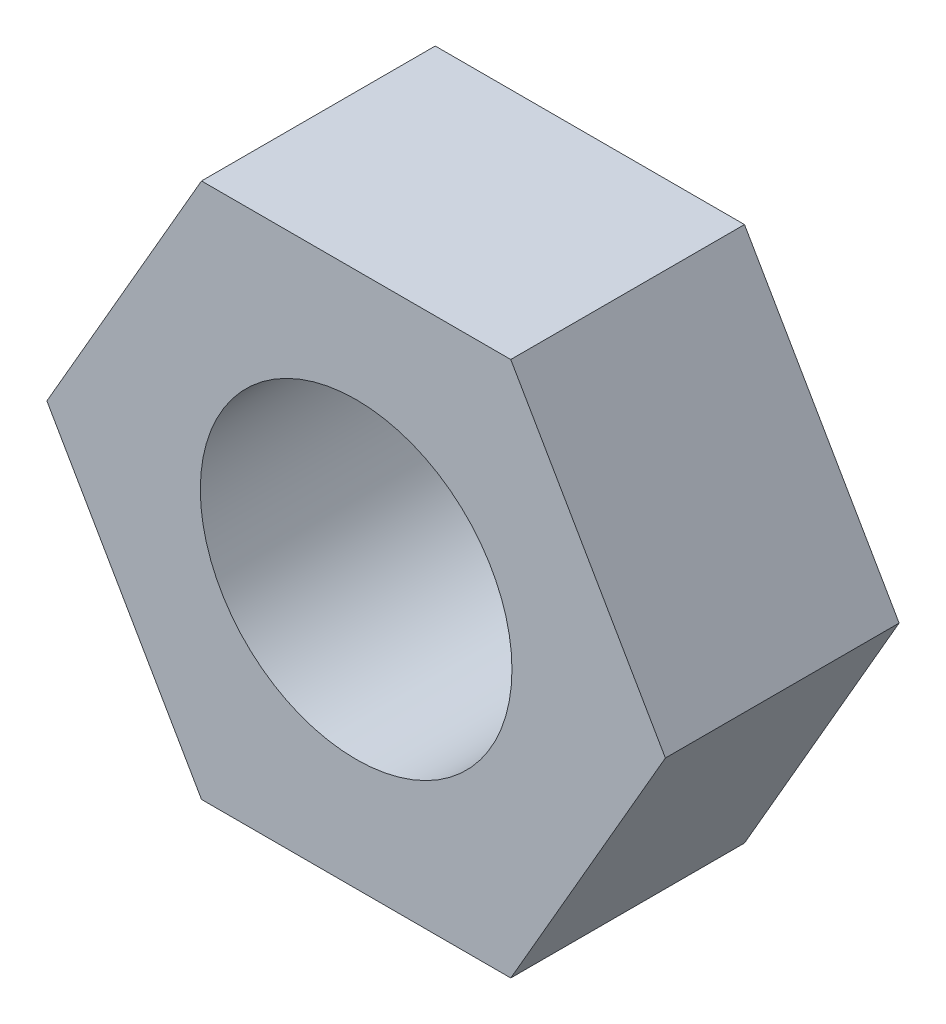
from build123d import *

# Parameters (mm, degrees)
SKETCH_1_R       = 1.6
EXTRUDE_M3_DEPTH = 2.4


with BuildPart() as part:
    # 草图1 → M3螺母 (new body)
    with BuildSketch(Plane.XY):
        Polygon((3.175426481, 0), (1.58771324, 2.75), (-1.58771324, 2.75), (-3.175426481, 0), (-1.58771324, -2.75), (1.58771324, -2.75), align=None)
        Circle(SKETCH_1_R, mode=Mode.SUBTRACT)
    extrude(amount=EXTRUDE_M3_DEPTH)


solid = part.part
